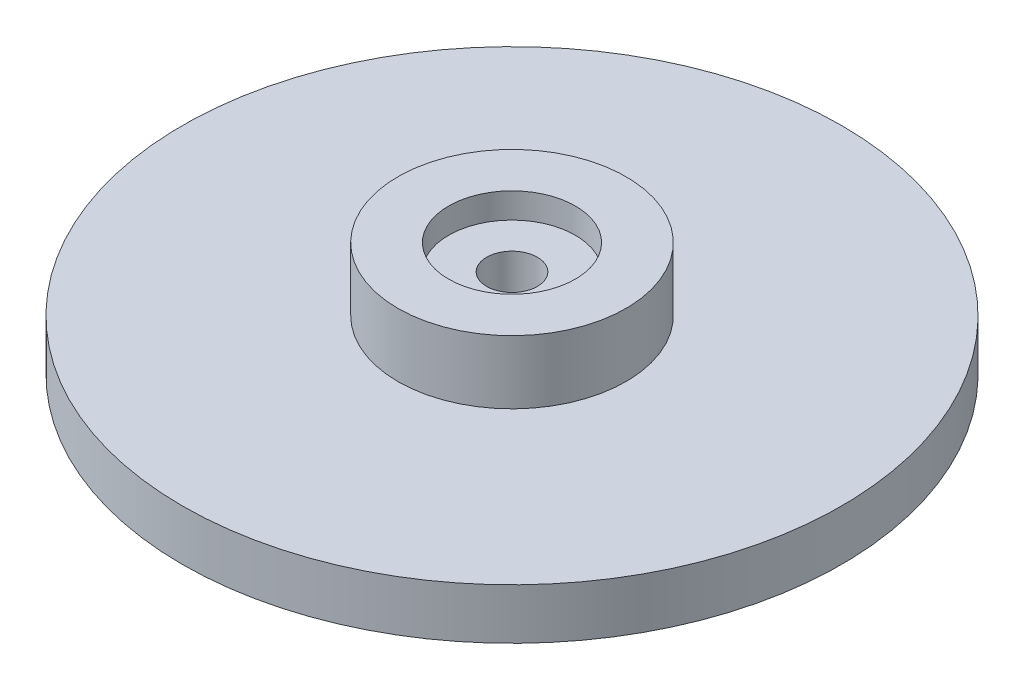
from build123d import *

# Parameters (mm, degrees)
SKETCH_2_R          = 13
EXTRUDE_1_DEPTH     = 2
SKETCH_3_R          = 4.5
SKETCH_3_R_2        = 2.5
EXTRUDE_2_DEPTH     = 2.5
SKETCH_4_R          = 2.5
EXTRUDE_3_DEPTH     = 1.5
SKETCH_5_R          = 2.6
CUT_EXTRUDE_1_DEPTH = 2
SKETCH_6_R          = 1
CUT_EXTRUDE_2_DEPTH = 2


with BuildPart() as part:
    # 草图2 → 凸台-拉伸1 (new body)
    with BuildSketch(Plane(origin=(0, 0, 0), x_dir=(1, 0, 0), z_dir=(0, 1, 0))):
        with Locations(Location((0, 0, 0), (0, 0, 270))):
            Circle(SKETCH_2_R)
    extrude(amount=EXTRUDE_1_DEPTH)

    # 草图3 → 凸台-拉伸2 (add)
    with BuildSketch(Plane(origin=(0, 2, 0), x_dir=(1, 0, 0), z_dir=(0, 1, 0))):
        with Locations(Location((0, 0, 0), (0, 0, 270))):
            Circle(SKETCH_3_R)
        with Locations(Location((0, 0, 0), (0, 0, 270))):
            Circle(SKETCH_3_R_2, mode=Mode.SUBTRACT)
    extrude(amount=EXTRUDE_2_DEPTH)

    # 草图4 → 凸台-拉伸3 (add)
    with BuildSketch(Plane(origin=(0, 2, 0), x_dir=(1, 0, 0), z_dir=(0, 1, 0))):
        with Locations(Location((0, 0, 0), (0, 0, 270))):
            Circle(SKETCH_4_R)
    extrude(amount=EXTRUDE_3_DEPTH)

    # 草图5 → 切除-拉伸1 (cut)
    with BuildSketch(Plane.XZ):
        with Locations(Location((0, 0, 0), (0, 0, 270))):
            Circle(SKETCH_5_R)
    extrude(amount=-CUT_EXTRUDE_1_DEPTH, mode=Mode.SUBTRACT)

    # 草图6 → 切除-拉伸2 (cut)
    with BuildSketch(Plane.XZ.offset(-2)):
        with Locations(Location((0, 0, 0), (0, 0, 270))):
            Circle(SKETCH_6_R)
    extrude(amount=-CUT_EXTRUDE_2_DEPTH, mode=Mode.SUBTRACT)


solid = part.part
